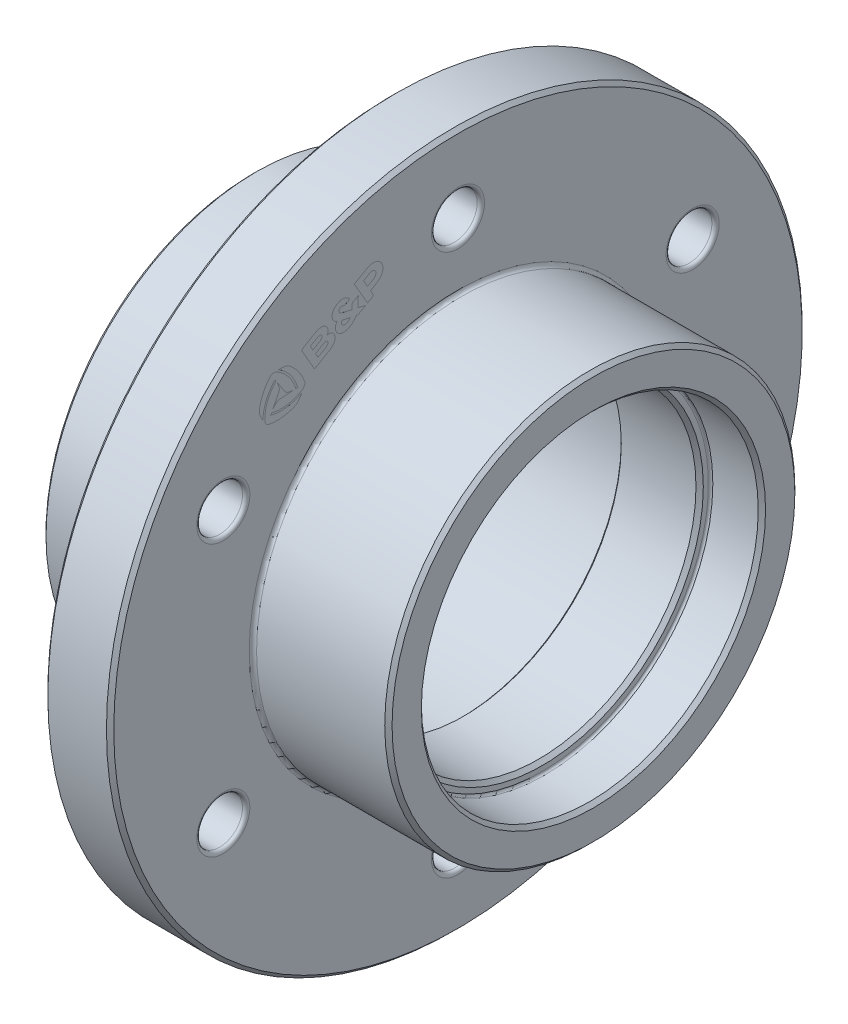
from build123d import *

# Parameters (mm, degrees)
CROQUIS2_R            = 3.125
CORTAR_EXTRUIR2_DEPTH = 82.699143202
CHAFL_N1_SIZE         = 0.5
REDONDEO2_R           = 0.5
CHAFL_N2_SIZE         = 0.3
CHAFL_N3_SIZE         = 1
CORTAR_EXTRUIR3_DEPTH = 0.0001


with BuildPart() as part:
    # Croquis1 → Revolución1 (revolve)
    with BuildSketch(Plane.XY, mode=Mode.PRIVATE) as revoluci_n1_sk:
        with BuildLine():
            Line((0, 23.5), (0, 28.75))
            Line((0, 28.75), (7.75, 28.75))
            Line((7.75, 28.75), (8, 29))
            Line((8, 29), (18, 29))
            ThreePointArc((18, 29), (18.707106781, 29.292893219), (19, 30))
            Line((19, 30), (19, 47.5))
            Line((19, 47.5), (28, 47.5))
            Line((28, 47.5), (28, 28.5))
            ThreePointArc((28, 28.5), (28.146446609, 28.146446609), (28.5, 28))
            Line((28.5, 28), (46.5, 28))
            Line((46.5, 28), (46.5, 23.5))
            Line((46.5, 23.5), (46, 23))
            Line((46, 23), (39.8, 23))
            ThreePointArc((39.8, 23), (39.587867966, 22.912132034), (39.5, 22.7))
            Line((39.5, 22.7), (39.5, 22))
            Line((39.5, 22), (39, 21.5))
            Line((39, 21.5), (28.5, 21.5))
            Line((28.5, 21.5), (28.5, 22.5))
            ThreePointArc((28.5, 22.5), (28.207106781, 23.207106781), (27.5, 23.5))
            Line((27.5, 23.5), (6.7, 23.5))
            Line((6.7, 23.5), (6.7, 24.75))
            Line((6.7, 24.75), (4.6, 24.75))
            Line((4.6, 24.75), (4.6, 23.5))
            Line((4.6, 23.5), (0, 23.5))
        make_face()
    revolve(revoluci_n1_sk.sketch.rotate(Axis((0, 0, 0), (1, 0, 0)), 90), axis=Axis((0, 0, 0), (1, 0, 0)))

    # Croquis2 → Cortar-Extruir2 (cut, through all)
    with BuildSketch(Plane(origin=(0, 0, 0), x_dir=(0, 0, -1), z_dir=(1, 0, 0))):
        with Locations(Location((0, 37, 0), (0, 0, 180))):
            Circle(CROQUIS2_R)
        with Locations(Location((32.04293994, 18.5, 0), (0, 0, 180))):
            Circle(CROQUIS2_R)
        with Locations(Location((32.04293994, -18.5, 0), (0, 0, 180))):
            Circle(CROQUIS2_R)
        with Locations(Location((0, -37, 0), (0, 0, 180))):
            Circle(CROQUIS2_R)
        with Locations(Location((-32.04293994, -18.5, 0), (0, 0, 180))):
            Circle(CROQUIS2_R)
        with Locations(Location((-32.04293994, 18.5, 0), (0, 0, 180))):
            Circle(CROQUIS2_R)
    extrude(amount=CORTAR_EXTRUIR2_DEPTH, mode=Mode.SUBTRACT)

    # Chaflán1
    chafl_n1_edges = [part.edges().sort_by_distance(p)[0] for p in [
        (46.5, 0, -28),
        (28, 0, -47.5),
        (19, 0, -47.5),
        (0, 0, -28.75),
    ]]
    chamfer(chafl_n1_edges, length=CHAFL_N1_SIZE)

    # Redondeo2
    redondeo2_edges = [part.edges().sort_by_distance(p)[0] for p in [
        (19, 37, -3.125),
        (28, 37, -3.125),
        (19, 18.5, 28.91793994),
        (28, 18.5, 28.91793994),
        (19, -18.5, 28.91793994),
        (28, -18.5, 28.91793994),
        (19, -37, -3.125),
        (28, -37, -3.125),
        (19, -18.5, -35.16793994),
        (28, -18.5, -35.16793994),
        (19, 18.5, -35.16793994),
        (28, 18.5, -35.16793994),
    ]]
    fillet(redondeo2_edges, radius=REDONDEO2_R)

    # Chaflán2
    chafl_n2_edges = [part.edges().sort_by_distance(p)[0] for p in [
        (28.5, 0, -21.5),
    ]]
    chamfer(chafl_n2_edges, length=CHAFL_N2_SIZE)

    # Chaflán3
    chafl_n3_edges = [part.edges().sort_by_distance(p)[0] for p in [
        (0, 0, -23.5),
    ]]
    chamfer(chafl_n3_edges, length=CHAFL_N3_SIZE)

    # Croquis3 → Cortar-Extruir3 (cut)
    # profile 1 of 4: a face of its own
    with BuildSketch(Plane(origin=(28, 0, 0), x_dir=(0, 0, -1), z_dir=(1, 0, 0))):
        with BuildLine():
            Line((-12.529389607, 37.194504593), (-14.151662683, 36.257884796))
            Line((-14.151662683, 36.257884796), (-12.345641116, 33.129763683))
            Line((-12.345641116, 33.129763683), (-11.722485549, 33.489542718))
            add(Edge.make_bspline(
                [(-11.722485549, 33.489542718), (-11.598392037, 33.56118814), (-11.555736271, 33.720395809), (-11.627381693, 33.84448932)],
                knots=[6, 6, 6, 6, 7, 7, 7, 7], degree=3))
            Line((-11.627381693, 33.84448932), (-11.940771699, 34.387296733))
            Line((-11.940771699, 34.387296733), (-11.236935346, 34.79365684))
            add(Edge.make_bspline(
                [(-11.236935346, 34.79365684), (-10.930529061, 34.970560591), (-10.688679271, 35.177551732), (-10.518092612, 35.408900248)],
                knots=[9, 9, 9, 9, 10, 10, 10, 10], degree=3))
            add(Edge.make_bspline(
                [(-10.518092612, 35.408900248), (-10.347534823, 35.640226103), (-10.253126954, 35.886165643), (-10.237496189, 36.139891967)],
                knots=[10, 10, 10, 10, 11, 11, 11, 11], degree=3))
            add(Edge.make_bspline(
                [(-10.237496189, 36.139891967), (-10.229888857, 36.263887067), (-10.263211285, 36.605465136), (-10.415097663, 36.869899939)],
                knots=[11, 11, 11, 11, 12, 12, 12, 12], degree=3))
            add(Edge.make_bspline(
                [(-10.415097663, 36.869899939), (-10.571559735, 37.142343122), (-10.851700235, 37.326695085), (-10.937517371, 37.36979352)],
                knots=[12, 12, 12, 12, 13, 13, 13, 13], degree=3))
            add(Edge.make_bspline(
                [(-10.937517371, 37.36979352), (-11.156396578, 37.479584945), (-11.405391305, 37.520872008), (-11.67756305, 37.492422479)],
                knots=[1, 1, 1, 1, 2, 2, 2, 2], degree=3))
            add(Edge.make_bspline(
                [(-11.67756305, 37.492422479), (-11.94987604, 37.46388541), (-12.236459338, 37.363627963), (-12.529389607, 37.194504593)],
                knots=[2, 2, 2, 2, 3, 3, 3, 3], degree=3))
        make_face()
        with BuildLine():
            Line((-11.594124175, 35.528237625), (-12.348151716, 35.092899621))
            Line((-12.348151716, 35.092899621), (-12.893338941, 36.037191594))
            Line((-12.893338941, 36.037191594), (-12.139311399, 36.472529598))
            add(Edge.make_bspline(
                [(-12.139311399, 36.472529598), (-11.95287671, 36.580167716), (-11.776752689, 36.624113172), (-11.615817608, 36.603119749)],
                knots=[5, 5, 5, 5, 6, 6, 6, 6], degree=3))
            add(Edge.make_bspline(
                [(-11.615817608, 36.603119749), (-11.512403914, 36.589575125), (-11.423462642, 36.549556992), (-11.351412717, 36.484120056)],
                knots=[6, 6, 6, 6, 7, 7, 7, 7], degree=3))
            add(Edge.make_bspline(
                [(-11.351412717, 36.484120056), (-11.285509709, 36.424315985), (-11.237654587, 36.343639585), (-11.213054781, 36.25086125)],
                knots=[7, 7, 7, 7, 8, 8, 8, 8], degree=3))
            add(Edge.make_bspline(
                [(-11.213054781, 36.25086125), (-11.184860885, 36.144539331), (-11.189712283, 36.036771096), (-11.227551168, 35.930622547)],
                knots=[0, 0, 0, 0, 1, 1, 1, 1], degree=3))
            add(Edge.make_bspline(
                [(-11.227551168, 35.930622547), (-11.284390193, 35.771233267), (-11.407725445, 35.635854982), (-11.594124175, 35.528237625)],
                knots=[1, 1, 1, 1, 2, 2, 2, 2], degree=3))
        make_face(mode=Mode.SUBTRACT)
    # profile 2 of 4: a face of its own
    with BuildSketch(Plane(origin=(28, 0, 0), x_dir=(0, 0, -1), z_dir=(1, 0, 0))):
        with BuildLine():
            Line((-13.673665795, 33.227836633), (-13.67007804, 33.268055606))
            Line((-13.67007804, 33.268055606), (-13.609002803, 34.657421683))
            Line((-13.609002803, 34.657421683), (-14.319797418, 34.24704422))
            add(Edge.make_bspline(
                [(-14.319797418, 34.24704422), (-14.396423712, 34.202804009), (-14.444839911, 34.123643844), (-14.449371588, 34.035304801)],
                knots=[3, 3, 3, 3, 4, 4, 4, 4], degree=3))
            Line((-14.449371588, 34.035304801), (-14.481441417, 33.40994607))
            Line((-14.481441417, 33.40994607), (-15.343642939, 33.605115234))
            add(Edge.make_bspline(
                [(-15.343642939, 33.605115234), (-15.633898134, 33.669472412), (-15.839302078, 33.723016981), (-15.954138038, 33.764338736)],
                knots=[6, 6, 6, 6, 7, 7, 7, 7], degree=3))
            add(Edge.make_bspline(
                [(-15.954138038, 33.764338736), (-16.068965839, 33.805563314), (-16.153135109, 33.871416899), (-16.204286312, 33.960013382)],
                knots=[7, 7, 7, 7, 8, 8, 8, 8], degree=3))
            add(Edge.make_bspline(
                [(-16.204286312, 33.960013382), (-16.257285291, 34.051810307), (-16.269114623, 34.144404082), (-16.23942475, 34.235341479)],
                knots=[8, 8, 8, 8, 9, 9, 9, 9], degree=3))
            add(Edge.make_bspline(
                [(-16.23942475, 34.235341479), (-16.209757538, 34.326307747), (-16.147470374, 34.399733598), (-16.05427101, 34.453542276)],
                knots=[9, 9, 9, 9, 10, 10, 10, 10], degree=3))
            add(Edge.make_bspline(
                [(-16.05427101, 34.453542276), (-15.957758829, 34.50926361), (-15.858133453, 34.523965958), (-15.758312724, 34.497253271)],
                knots=[10, 10, 10, 10, 11, 11, 11, 11], degree=3))
            add(Edge.make_bspline(
                [(-15.758312724, 34.497253271), (-15.728609823, 34.489260206), (-15.699379277, 34.477320513), (-15.671408977, 34.461698501)],
                knots=[11, 11, 11, 11, 12, 12, 12, 12], degree=3))
            add(Edge.make_bspline(
                [(-15.671408977, 34.461698501), (-15.593750835, 34.418354504), (-15.495222568, 34.420496698), (-15.414285568, 34.467225697)],
                knots=[12, 12, 12, 12, 13, 13, 13, 13], degree=3))
            Line((-15.414285568, 34.467225697), (-14.79230769, 34.826324792))
            Line((-14.79230769, 34.826324792), (-14.800375721, 34.836302438))
            add(Edge.make_bspline(
                [(-14.800375721, 34.836302438), (-14.994569055, 35.076311309), (-15.229265164, 35.227782341), (-15.497938374, 35.286482031)],
                knots=[15, 15, 15, 15, 16, 16, 16, 16], degree=3))
            add(Edge.make_bspline(
                [(-15.497938374, 35.286482031), (-15.80276596, 35.353034039), (-16.126191343, 35.289287553), (-16.459217028, 35.097015085)],
                knots=[16, 16, 16, 16, 17, 17, 17, 17], degree=3))
            add(Edge.make_bspline(
                [(-16.459217028, 35.097015085), (-16.685607787, 34.966308319), (-16.862844306, 34.807277819), (-16.986049175, 34.624399713)],
                knots=[17, 17, 17, 17, 18, 18, 18, 18], degree=3))
            add(Edge.make_bspline(
                [(-16.986049175, 34.624399713), (-17.109129896, 34.441545337), (-17.178005002, 34.248836346), (-17.190709302, 34.051692577)],
                knots=[18, 18, 18, 18, 19, 19, 19, 19], degree=3))
            add(Edge.make_bspline(
                [(-17.190709302, 34.051692577), (-17.203449561, 33.854528048), (-17.158947412, 33.666301249), (-17.058474615, 33.492277259)],
                knots=[19, 19, 19, 19, 20, 20, 20, 20], degree=3))
            add(Edge.make_bspline(
                [(-17.058474615, 33.492277259), (-16.9488382, 33.302381418), (-16.769377371, 33.151420254), (-16.525172757, 33.043688428)],
                knots=[20, 20, 20, 20, 21, 21, 21, 21], degree=3))
            add(Edge.make_bspline(
                [(-16.525172757, 33.043688428), (-16.648718582, 32.849909373), (-16.722016786, 32.64930065), (-16.743010936, 32.447466627)],
                knots=[21, 21, 21, 21, 22, 22, 22, 22], degree=3))
            add(Edge.make_bspline(
                [(-16.743010936, 32.447466627), (-16.764056246, 32.245555121), (-16.719176735, 32.046896035), (-16.609561081, 31.857036154)],
                knots=[22, 22, 22, 22, 23, 23, 23, 23], degree=3))
            add(Edge.make_bspline(
                [(-16.609561081, 31.857036154), (-16.494417672, 31.65760192), (-16.337141205, 31.509936701), (-16.142049165, 31.418134474)],
                knots=[23, 23, 23, 23, 24, 24, 24, 24], degree=3))
            add(Edge.make_bspline(
                [(-16.142049165, 31.418134474), (-15.946868888, 31.326179416), (-15.723341761, 31.293802369), (-15.477498694, 31.321836588)],
                knots=[24, 24, 24, 24, 25, 25, 25, 25], degree=3))
            add(Edge.make_bspline(
                [(-15.477498694, 31.321836588), (-15.231685365, 31.34985577), (-14.977061504, 31.43913862), (-14.720590292, 31.587222951)],
                knots=[25, 25, 25, 25, 26, 26, 26, 26], degree=3))
            add(Edge.make_bspline(
                [(-14.720590292, 31.587222951), (-14.337561021, 31.808372641), (-14.056760047, 32.090246637), (-13.886002317, 32.425048445)],
                knots=[26, 26, 26, 26, 27, 27, 27, 27], degree=3))
            Line((-13.886002317, 32.425048445), (-13.746165677, 32.396542639))
            add(Edge.make_bspline(
                [(-13.746165677, 32.396542639), (-13.683982327, 32.383832268), (-13.619410317, 32.394358685), (-13.564395992, 32.426121221)],
                knots=[29, 29, 29, 29, 30, 30, 30, 30], degree=3))
            Line((-13.564395992, 32.426121221), (-12.597939166, 32.98410533))
            Line((-12.597939166, 32.98410533), (-13.673665795, 33.227836633))
        make_face()
        with BuildLine():
            Line((-15.810949079, 32.826661518), (-14.706087515, 32.593620095))
            add(Edge.make_bspline(
                [(-14.706087515, 32.593620095), (-14.807590678, 32.44644171), (-14.931671524, 32.329877557), (-15.074877782, 32.247197385)],
                knots=[0, 0, 0, 0, 1, 1, 1, 1], degree=3))
            add(Edge.make_bspline(
                [(-15.074877782, 32.247197385), (-15.224822048, 32.160627022), (-15.376702828, 32.1253803), (-15.526291216, 32.142364482)],
                knots=[1, 1, 1, 1, 2, 2, 2, 2], degree=3))
            add(Edge.make_bspline(
                [(-15.526291216, 32.142364482), (-15.675894802, 32.159291943), (-15.784205815, 32.224015045), (-15.848156498, 32.334780876)],
                knots=[2, 2, 2, 2, 3, 3, 3, 3], degree=3))
            add(Edge.make_bspline(
                [(-15.848156498, 32.334780876), (-15.890164845, 32.407541468), (-15.907127342, 32.487600253), (-15.898517597, 32.572695995)],
                knots=[3, 3, 3, 3, 4, 4, 4, 4], degree=3))
            add(Edge.make_bspline(
                [(-15.898517597, 32.572695995), (-15.889979772, 32.657750214), (-15.860495803, 32.743168737), (-15.810949079, 32.826661518)],
                knots=[4, 4, 4, 4, 5, 5, 5, 5], degree=3))
        make_face(mode=Mode.SUBTRACT)
    # profile 3 of 4: a face of its own
    with BuildSketch(Plane(origin=(28, 0, 0), x_dir=(0, 0, -1), z_dir=(1, 0, 0))):
        with BuildLine():
            Line((-19.51169407, 33.163275226), (-21.163099251, 32.209835999))
            add(Edge.make_bspline(
                [(-21.163099251, 32.209835999), (-21.287192763, 32.138190577), (-21.329851124, 31.978987404), (-21.258205702, 31.854893892)],
                knots=[6, 6, 6, 6, 7, 7, 7, 7], degree=3))
            Line((-21.258205702, 31.854893892), (-19.582081202, 28.951761098))
            Line((-19.582081202, 28.951761098), (-17.605273859, 30.09307135))
            add(Edge.make_bspline(
                [(-17.605273859, 30.09307135), (-17.228943328, 30.310345883), (-16.975251862, 30.566990208), (-16.851189578, 30.855876015)],
                knots=[9, 9, 9, 9, 10, 10, 10, 10], degree=3))
            add(Edge.make_bspline(
                [(-16.851189578, 30.855876015), (-16.727120205, 31.144759922), (-16.743889158, 31.429171339), (-16.900957868, 31.701222326)],
                knots=[10, 10, 10, 10, 11, 11, 11, 11], degree=3))
            add(Edge.make_bspline(
                [(-16.900957868, 31.701222326), (-16.921877698, 31.737456534), (-16.945293794, 31.772740976), (-16.970548047, 31.806029198)],
                knots=[11, 11, 11, 11, 12, 12, 12, 12], degree=3))
            add(Edge.make_bspline(
                [(-16.970548047, 31.806029198), (-17.060460718, 31.92468243), (-17.176017274, 32.014194099), (-17.313980105, 32.072112247)],
                knots=[0, 0, 0, 0, 1, 1, 1, 1], degree=3))
            add(Edge.make_bspline(
                [(-17.313980105, 32.072112247), (-17.4811765, 32.142214072), (-17.681088526, 32.14261602), (-17.892259445, 32.073234012)],
                knots=[1, 1, 1, 1, 2, 2, 2, 2], degree=3))
            add(Edge.make_bspline(
                [(-17.892259445, 32.073234012), (-17.65787179, 32.41756338), (-17.672567307, 32.651275603), (-17.839017086, 32.978347223)],
                knots=[2, 2, 2, 2, 3, 3, 3, 3], degree=3))
            add(Edge.make_bspline(
                [(-17.839017086, 32.978347223), (-17.992405816, 33.244024297), (-18.21980349, 33.396131061), (-18.514939305, 33.430418715)],
                knots=[3, 3, 3, 3, 4, 4, 4, 4], degree=3))
            add(Edge.make_bspline(
                [(-18.514939305, 33.430418715), (-18.81012628, 33.464628886), (-19.145454818, 33.374723556), (-19.51169407, 33.163275226)],
                knots=[4, 4, 4, 4, 5, 5, 5, 5], degree=3))
        make_face()
        with BuildLine():
            Line((-18.912603782, 31.824235755), (-19.810350013, 31.305921727))
            Line((-19.810350013, 31.305921727), (-20.160072684, 31.911659163))
            Line((-20.160072684, 31.911659163), (-19.262326454, 32.429973191))
            add(Edge.make_bspline(
                [(-19.262326454, 32.429973191), (-19.099234308, 32.524134486), (-18.959387991, 32.568495247), (-18.846639373, 32.561910399)],
                knots=[5, 5, 5, 5, 6, 6, 6, 6], degree=3))
            add(Edge.make_bspline(
                [(-18.846639373, 32.561910399), (-18.788252245, 32.558401609), (-18.736268653, 32.541672326), (-18.692152144, 32.512202097)],
                knots=[6, 6, 6, 6, 7, 7, 7, 7], degree=3))
            add(Edge.make_bspline(
                [(-18.692152144, 32.512202097), (-18.625153336, 32.467420686), (-18.580103725, 32.390326739), (-18.5715386, 32.30601307)],
                knots=[7, 7, 7, 7, 8, 8, 8, 8], degree=3))
            add(Edge.make_bspline(
                [(-18.5715386, 32.30601307), (-18.565531374, 32.246880953), (-18.575904407, 32.186784246), (-18.602396931, 32.127305911)],
                knots=[0, 0, 0, 0, 1, 1, 1, 1], degree=3))
            add(Edge.make_bspline(
                [(-18.602396931, 32.127305911), (-18.651680043, 32.016563795), (-18.756065349, 31.914613262), (-18.912603782, 31.824235755)],
                knots=[1, 1, 1, 1, 2, 2, 2, 2], degree=3))
        make_face(mode=Mode.SUBTRACT)
        with BuildLine():
            Line((-18.101105815, 30.696842936), (-19.11930011, 30.108988185))
            Line((-19.11930011, 30.108988185), (-19.455247511, 30.690866153))
            Line((-19.455247511, 30.690866153), (-18.421954505, 31.287438148))
            add(Edge.make_bspline(
                [(-18.421954505, 31.287438148), (-18.265564407, 31.377730013), (-18.129156074, 31.422263455), (-18.016559548, 31.419762157)],
                knots=[6, 6, 6, 6, 7, 7, 7, 7], degree=3))
            add(Edge.make_bspline(
                [(-18.016559548, 31.419762157), (-17.953856559, 31.418307618), (-17.898951499, 31.401449064), (-17.853306014, 31.369673135)],
                knots=[7, 7, 7, 7, 8, 8, 8, 8], degree=3))
            add(Edge.make_bspline(
                [(-17.853306014, 31.369673135), (-17.796568903, 31.330156688), (-17.758577392, 31.265972858), (-17.749149953, 31.193598324)],
                knots=[0, 0, 0, 0, 1, 1, 1, 1], degree=3))
            add(Edge.make_bspline(
                [(-17.749149953, 31.193598324), (-17.741235116, 31.132864573), (-17.751071091, 31.070135208), (-17.778344423, 31.007161458)],
                knots=[1, 1, 1, 1, 2, 2, 2, 2], degree=3))
            add(Edge.make_bspline(
                [(-17.778344423, 31.007161458), (-17.82596888, 30.897376968), (-17.934588478, 30.792981765), (-18.101105815, 30.696842936)],
                knots=[2, 2, 2, 2, 3, 3, 3, 3], degree=3))
        make_face(mode=Mode.SUBTRACT)
    # profile 4 of 4: a face of its own
    with BuildSketch(Plane(origin=(28, 0, 0), x_dir=(0, 0, -1), z_dir=(1, 0, 0))):
        with BuildLine():
            Line((-21.894298338, 27.906657601), (-22.141900826, 27.892632872))
            add(Edge.make_bspline(
                [(-22.141900826, 27.892632872), (-22.224930625, 28.17718188), (-22.331798616, 28.458719945), (-22.463691226, 28.734698155)],
                knots=[6, 6, 6, 6, 7, 7, 7, 7], degree=3))
            add(Edge.make_bspline(
                [(-22.463691226, 28.734698155), (-23.001136362, 29.859472304), (-23.870135758, 30.721047325), (-24.898134328, 31.258486482)],
                knots=[7, 7, 7, 7, 8, 8, 8, 8], degree=3))
            add(Edge.make_bspline(
                [(-24.898134328, 31.258486482), (-24.947142278, 31.284101783), (-25.002717878, 31.294388078), (-25.057670805, 31.287946873)],
                knots=[8, 8, 8, 8, 9, 9, 9, 9], degree=3))
            add(Edge.make_bspline(
                [(-25.057670805, 31.287946873), (-25.186094293, 31.27286586), (-25.31447363, 31.253291362), (-25.442602692, 31.229198545)],
                knots=[9, 9, 9, 9, 10, 10, 10, 10], degree=3))
            add(Edge.make_bspline(
                [(-25.442602692, 31.229198545), (-25.501314729, 31.218129751), (-25.554836479, 31.188115967), (-25.594904368, 31.143820293)],
                knots=[10, 10, 10, 10, 11, 11, 11, 11], degree=3))
            add(Edge.make_bspline(
                [(-25.594904368, 31.143820293), (-25.765426019, 30.955127918), (-25.925989931, 30.753527393), (-26.075027634, 30.539193087)],
                knots=[11, 11, 11, 11, 12, 12, 12, 12], degree=3))
            add(Edge.make_bspline(
                [(-26.075027634, 30.539193087), (-26.673504382, 29.67872697), (-27.016176455, 28.716632984), (-27.119299932, 27.743051009)],
                knots=[12, 12, 12, 12, 13, 13, 13, 13], degree=3))
            add(Edge.make_bspline(
                [(-27.119299932, 27.743051009), (-27.13777824, 27.568494792), (-27.112307966, 27.392060603), (-27.047483527, 27.228926029)],
                knots=[13, 13, 13, 13, 14, 14, 14, 14], degree=3))
            add(Edge.make_bspline(
                [(-27.047483527, 27.228926029), (-26.932164364, 26.938620425), (-26.792557495, 26.656931347), (-26.629301524, 26.387175997)],
                knots=[14, 14, 14, 14, 15, 15, 15, 15], degree=3))
            add(Edge.make_bspline(
                [(-26.629301524, 26.387175997), (-26.625105841, 26.752380971), (-26.586230254, 27.116787549), (-26.512532906, 27.478032352)],
                knots=[15, 15, 15, 15, 16, 16, 16, 16], degree=3))
            add(Edge.make_bspline(
                [(-26.512532906, 27.478032352), (-26.357286516, 28.238623808), (-26.054024951, 28.951529914), (-25.611110493, 29.596879435)],
                knots=[16, 16, 16, 16, 17, 17, 17, 17], degree=3))
            add(Edge.make_bspline(
                [(-25.611110493, 29.596879435), (-25.421136477, 29.873739087), (-25.210227186, 30.130921046), (-24.979833625, 30.367533636)],
                knots=[17, 17, 17, 17, 18, 18, 18, 18], degree=3))
            Line((-24.979833625, 30.367533636), (-24.843921574, 30.160108402))
            add(Edge.make_bspline(
                [(-24.843921574, 30.160108402), (-25.048821609, 29.945921936), (-25.239180306, 29.712585545), (-25.412271903, 29.460402361)],
                knots=[19, 19, 19, 19, 20, 20, 20, 20], degree=3))
            add(Edge.make_bspline(
                [(-25.412271903, 29.460402361), (-26.117628068, 28.432572871), (-26.429230121, 27.249217154), (-26.380694348, 26.090259186)],
                knots=[20, 20, 20, 20, 21, 21, 21, 21], degree=3))
            add(Edge.make_bspline(
                [(-26.380694348, 26.090259186), (-26.378385487, 26.034979159), (-26.359512719, 25.981710706), (-26.326446352, 25.937362125)],
                knots=[21, 21, 21, 21, 22, 22, 22, 22], degree=3))
            add(Edge.make_bspline(
                [(-26.326446352, 25.937362125), (-26.249185074, 25.833645876), (-26.168043244, 25.732224005), (-26.083106876, 25.633328538)],
                knots=[22, 22, 22, 22, 23, 23, 23, 23], degree=3))
            add(Edge.make_bspline(
                [(-26.083106876, 25.633328538), (-26.044193895, 25.588040299), (-25.991430258, 25.556688136), (-25.933036435, 25.544157249)],
                knots=[23, 23, 23, 23, 24, 24, 24, 24], degree=3))
            add(Edge.make_bspline(
                [(-25.933036435, 25.544157249), (-25.684376751, 25.49078597), (-25.429484643, 25.452556148), (-25.169324837, 25.430624891)],
                knots=[24, 24, 24, 24, 25, 25, 25, 25], degree=3))
            add(Edge.make_bspline(
                [(-25.169324837, 25.430624891), (-24.124906069, 25.34257677), (-23.120378434, 25.52686705), (-22.225685926, 25.924354405)],
                knots=[25, 25, 25, 25, 26, 26, 26, 26], degree=3))
            add(Edge.make_bspline(
                [(-22.225685926, 25.924354405), (-22.065276503, 25.995606581), (-21.925196778, 26.105890945), (-21.816327105, 26.243621622)],
                knots=[26, 26, 26, 26, 27, 27, 27, 27], degree=3))
            add(Edge.make_bspline(
                [(-21.816327105, 26.243621622), (-21.622594739, 26.488626992), (-21.448437059, 26.750361742), (-21.296469075, 27.026638849)],
                knots=[27, 27, 27, 27, 28, 28, 28, 28], degree=3))
            add(Edge.make_bspline(
                [(-21.296469075, 27.026638849), (-21.614787271, 26.847664408), (-21.949852866, 26.69914024), (-22.299544406, 26.58233312)],
                knots=[28, 28, 28, 28, 29, 29, 29, 29], degree=3))
            add(Edge.make_bspline(
                [(-22.299544406, 26.58233312), (-23.03585476, 26.336478813), (-23.804853757, 26.242657666), (-24.585254653, 26.303540282)],
                knots=[29, 29, 29, 29, 30, 30, 30, 30], degree=3))
            add(Edge.make_bspline(
                [(-24.585254653, 26.303540282), (-24.919962253, 26.329664828), (-25.248153096, 26.383704968), (-25.568281769, 26.464940738)],
                knots=[30, 30, 30, 30, 31, 31, 31, 31], degree=3))
            Line((-25.568281769, 26.464940738), (-25.456467074, 26.686606281))
            add(Edge.make_bspline(
                [(-25.456467074, 26.686606281), (-25.168539487, 26.616242443), (-24.871373246, 26.56780809), (-24.566483968, 26.544006202)],
                knots=[32, 32, 32, 32, 33, 33, 33, 33], degree=3))
            add(Edge.make_bspline(
                [(-24.566483968, 26.544006202), (-23.323661905, 26.447025583), (-22.143047854, 26.768867496), (-21.163582461, 27.390381812)],
                knots=[33, 33, 33, 33, 34, 34, 34, 34], degree=3))
            add(Edge.make_bspline(
                [(-21.163582461, 27.390381812), (-21.116919332, 27.420025777), (-21.080219095, 27.46301243), (-21.05832994, 27.51379772)],
                knots=[34, 34, 34, 34, 35, 35, 35, 35], degree=3))
            add(Edge.make_bspline(
                [(-21.05832994, 27.51379772), (-21.007185176, 27.632536963), (-20.959939858, 27.753441949), (-20.916782776, 27.876403678)],
                knots=[35, 35, 35, 35, 36, 36, 36, 36], degree=3))
            add(Edge.make_bspline(
                [(-20.916782776, 27.876403678), (-20.896966275, 27.93281873), (-20.896138836, 27.994230695), (-20.91450889, 28.051133672)],
                knots=[36, 36, 36, 36, 37, 37, 37, 37], degree=3))
            add(Edge.make_bspline(
                [(-20.91450889, 28.051133672), (-20.99262097, 28.293152375), (-21.086993284, 28.533059137), (-21.198058666, 28.769309501)],
                knots=[37, 37, 37, 37, 38, 38, 38, 38], degree=3))
            add(Edge.make_bspline(
                [(-21.198058666, 28.769309501), (-21.644000686, 29.71782374), (-22.305856248, 30.495627446), (-23.097425279, 31.071722065)],
                knots=[38, 38, 38, 38, 39, 39, 39, 39], degree=3))
            add(Edge.make_bspline(
                [(-23.097425279, 31.071722065), (-23.239356393, 31.175026107), (-23.404903797, 31.241171436), (-23.578621267, 31.266615788)],
                knots=[0, 0, 0, 0, 1, 1, 1, 1], degree=3))
            add(Edge.make_bspline(
                [(-23.578621267, 31.266615788), (-23.887692836, 31.311862498), (-24.201416583, 31.33183439), (-24.51667425, 31.32529317)],
                knots=[1, 1, 1, 1, 2, 2, 2, 2], degree=3))
            add(Edge.make_bspline(
                [(-24.51667425, 31.32529317), (-24.202479818, 31.13910416), (-23.906330265, 30.923198393), (-23.63037238, 30.678745741)],
                knots=[2, 2, 2, 2, 3, 3, 3, 3], degree=3))
            add(Edge.make_bspline(
                [(-23.63037238, 30.678745741), (-23.049267613, 30.164026157), (-22.583532777, 29.544945692), (-22.246061189, 28.838651041)],
                knots=[3, 3, 3, 3, 4, 4, 4, 4], degree=3))
            add(Edge.make_bspline(
                [(-22.246061189, 28.838651041), (-22.101312407, 28.535723565), (-21.984010093, 28.224465506), (-21.894298338, 27.906657601)],
                knots=[4, 4, 4, 4, 5, 5, 5, 5], degree=3))
        make_face()
        with BuildLine():
            Line((-24.892292612, 27.472968344), (-25.324380763, 26.948503924))
            Line((-25.324380763, 26.948503924), (-24.480737773, 28.621135128))
            add(Edge.make_bspline(
                [(-24.480737773, 28.621135128), (-24.37764187, 28.825498516), (-24.36462166, 29.063675251), (-24.444870275, 29.278101735)],
                knots=[3, 3, 3, 3, 4, 4, 4, 4], degree=3))
            Line((-24.444870275, 29.278101735), (-24.683017078, 29.914574983))
            Line((-24.683017078, 29.914574983), (-23.656276489, 28.347617519))
            add(Edge.make_bspline(
                [(-23.656276489, 28.347617519), (-23.53084847, 28.156134868), (-23.331082764, 28.02579084), (-23.105307566, 27.988077095)],
                knots=[6, 6, 6, 6, 7, 7, 7, 7], degree=3))
            Line((-23.105307566, 27.988077095), (-22.434975089, 27.876070632))
            Line((-22.434975089, 27.876070632), (-24.305394628, 27.770376131))
            add(Edge.make_bspline(
                [(-24.305394628, 27.770376131), (-24.533935995, 27.757437375), (-24.746688547, 27.649629924), (-24.892292612, 27.472968344)],
                knots=[0, 0, 0, 0, 1, 1, 1, 1], degree=3))
        make_face(mode=Mode.SUBTRACT)
    extrude(amount=-CORTAR_EXTRUIR3_DEPTH, mode=Mode.SUBTRACT)


solid = part.part
